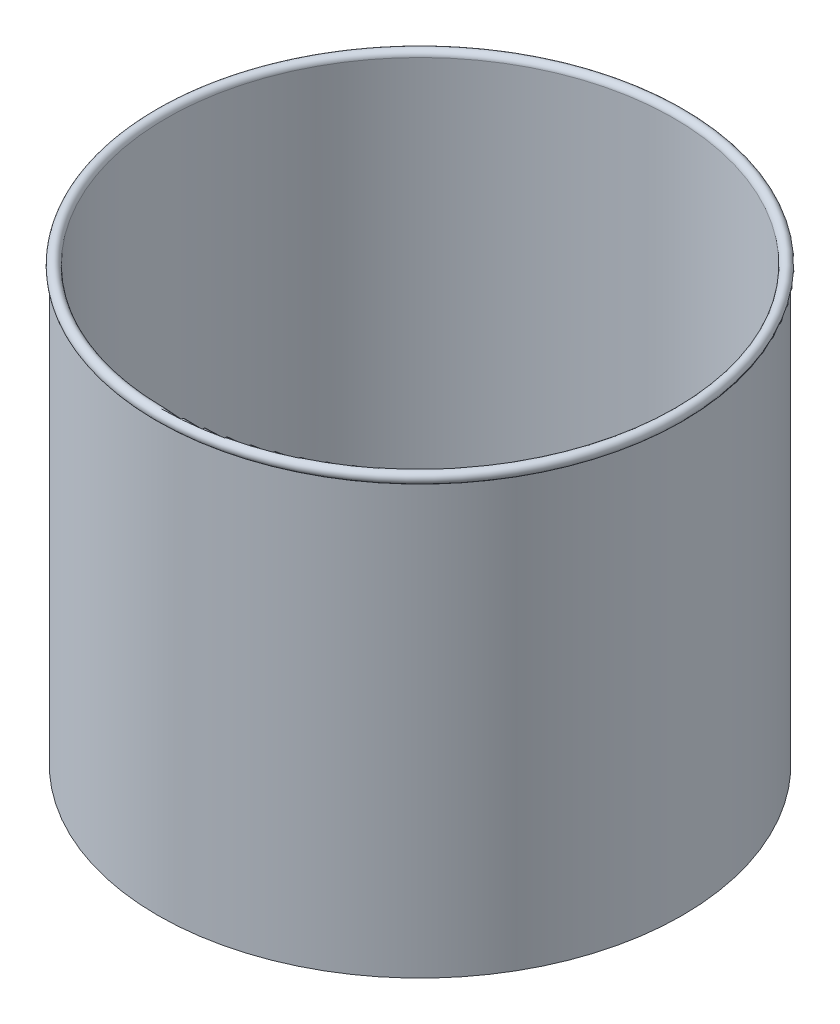
from build123d import *

# Parameters (mm, degrees)
SKETCH3_R           = 122.5
SKETCH3_R_2         = 118.5
EXTRUDE_THIN1_DEPTH = 192
SKETCH3_3_R         = 122.5
BOSS_EXTRUDE4_DEPTH = 10
SKETCH11_R          = 5
BOSS_EXTRUDE5_DEPTH = 20
SKETCH13_R          = 27.5
CUT_EXTRUDE2_DEPTH  = 9
CIRPATTERN1_COUNT   = 6
SKETCH23_R          = 12.5
SKETCH23_R_2        = 10.5
EXTRUDE_THIN2_DEPTH = 9


with BuildPart() as part:
    # Sketch3 → Extrude-Thin1 (new body)
    with BuildSketch(Plane(origin=(0, 0, 0), x_dir=(1, 0, 0), z_dir=(0, 1, 0))):
        Circle(SKETCH3_R)
        Circle(SKETCH3_R_2, mode=Mode.SUBTRACT)
    extrude(amount=EXTRUDE_THIN1_DEPTH)

    # Sketch9 → Revolve2 (revolve)
    with BuildSketch(Plane.XY):
        with BuildLine():
            Line((121.305664583, 189.351586859), (121.305664583, 192))
            Line((121.305664583, 192), (118.5, 192))
            ThreePointArc((118.5, 192), (122.710443221, 193.650108285), (121.305664583, 189.351586859))
        make_face()
    revolve(axis=Axis((0, -1000, 0), (0, 1, 0)))


with BuildPart() as body_2:
    # Sketch3<3> → Boss-Extrude4 (new body)
    with BuildSketch(Plane(origin=(0, 0, 0), x_dir=(1, 0, 0), z_dir=(0, 1, 0))):
        Circle(SKETCH3_3_R)
    extrude(amount=-BOSS_EXTRUDE4_DEPTH)


    add(part.part)  # Boss-Extrude5 merges part
    # Sketch11 → Boss-Extrude5 (add)
    with BuildSketch(Plane(origin=(0, 0, 0), x_dir=(1, 0, 0), z_dir=(0, 1, 0))):
        Circle(SKETCH11_R)
    extrude(amount=BOSS_EXTRUDE5_DEPTH)

    # Sketch13 → Cut-Extrude2 (cut)
    with BuildSketch(Plane.XZ.offset(10)):
        Circle(SKETCH13_R)
    extrude(amount=-CUT_EXTRUDE2_DEPTH, mode=Mode.SUBTRACT)

    # Sketch15 for Loft10 → Loft10 section 0
    with BuildSketch(Plane.XZ.offset(1)):
        with BuildLine():
            Line((0, -15), (0, -27.124270964))
            # circular arc as an exact rational Bezier (weights 1, cos(half-angle), 1)
            Bezier((0, -27.124270964), (2.164566304, -27.124270964), (4.301737718, -26.780984447), weights=[1, 0.996830963, 1])
            Line((4.301737718, -26.780984447), (6.447780139, -13.543490366))
            Bezier((6.447780139, -13.543490366), (3.388397874, -15), (0, -15), weights=[1, 0.975422821, 1])
        make_face()
    # Sketch19 for Loft10 → Loft10 section 1
    with BuildSketch(Plane(origin=(0, -9, 0), x_dir=(1, 0, 0), z_dir=(0, 1, 0))):
        with BuildLine():
            Line((-0.43008531, 27.094099047), (-0.43008531, 14.993980537))
            Bezier((-0.43008531, 14.993980537), (0.03482173, 15.006996741), (0.49966504, 14.99187476), weights=[1, 0.999542352, 1])
            Line((0.49966504, 14.99187476), (0.49966504, 27.159324131))
            Line((0.49966504, 27.159324131), (-0.43008531, 27.094099047))
        make_face()
    loft10 = loft()

    # CirPattern1: Loft10 ×6 about axis
    cirpattern1_axis = Axis((0, -1000, 0), (0, 1, 0))
    for i in range(1, CIRPATTERN1_COUNT):
        add(loft10.rotate(cirpattern1_axis, i * 360 / CIRPATTERN1_COUNT))

    # Sketch23 → Extrude-Thin2 (add)
    with BuildSketch(Plane(origin=(0, -1, 0), x_dir=(-1, 0, 0), z_dir=(0, -1, 0))):
        Circle(SKETCH23_R)
        Circle(SKETCH23_R_2, mode=Mode.SUBTRACT)
    extrude(amount=EXTRUDE_THIN2_DEPTH)


solid = body_2.part
